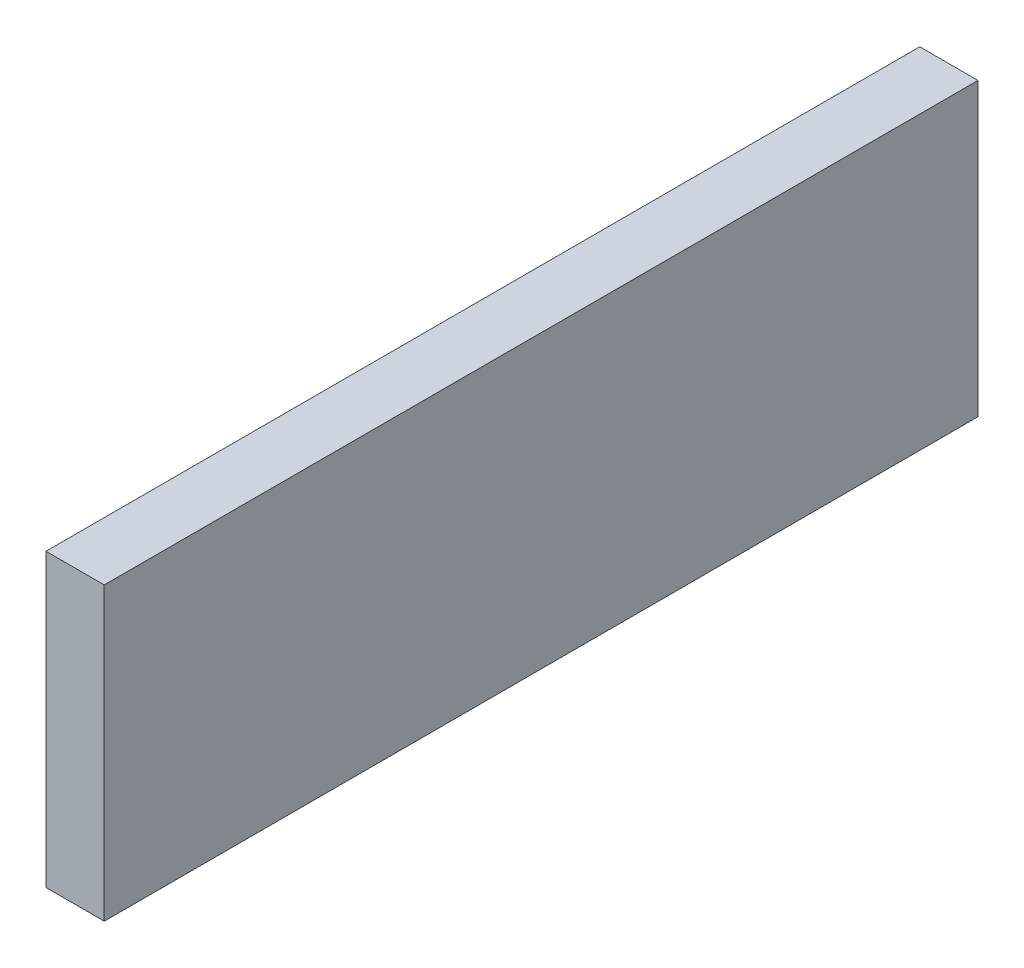
from build123d import *

# Parameters (mm, degrees)
SKETCH_1_W      = 20
SKETCH_1_H      = 300
EXTRUDE_1_DEPTH = 100


with BuildPart() as part:
    # 草图1 → 凸台-拉伸1 (new body)
    with BuildSketch(Plane(origin=(0, 0, 0), x_dir=(1, 0, 0), z_dir=(0, 1, 0))):
        with Locations((10, -150)):
            Rectangle(SKETCH_1_W, SKETCH_1_H)
    extrude(amount=EXTRUDE_1_DEPTH)


solid = part.part
